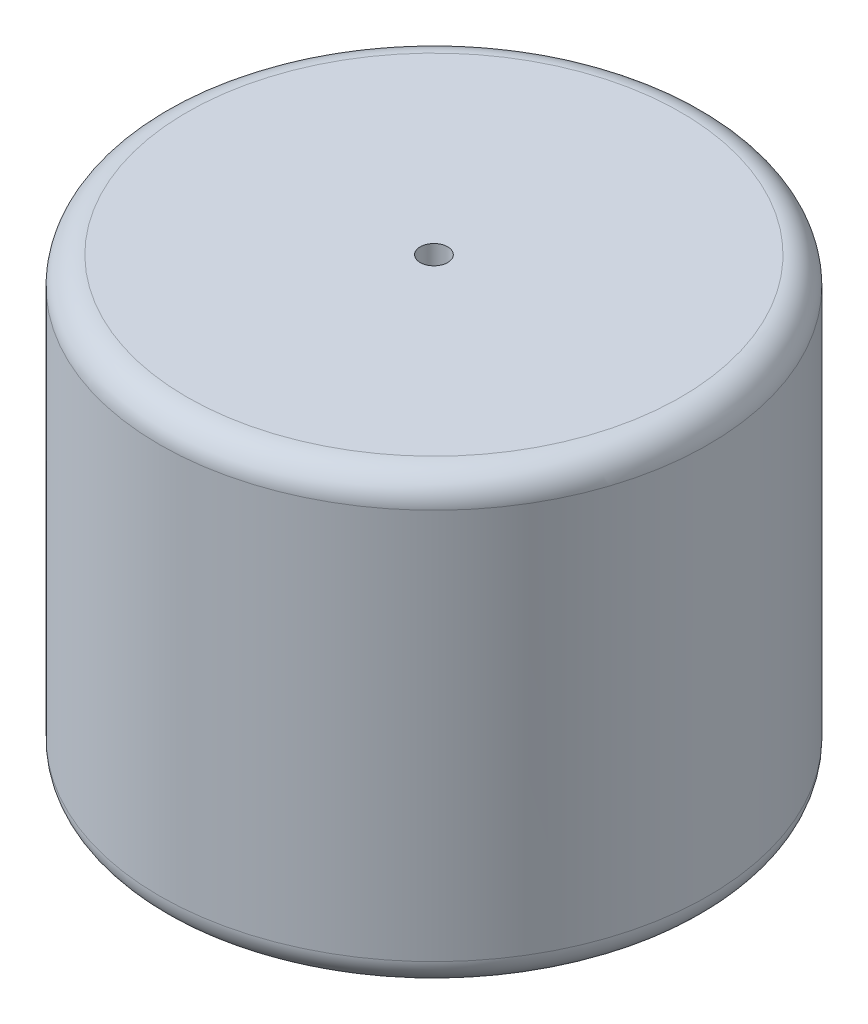
from build123d import *

# Parameters (mm, degrees)
SKETCH1_R           = 20
BOSS_EXTRUDE1_DEPTH = 7.5
SKETCH2_R           = 20
SKETCH2_R_2         = 12.5
BOSS_EXTRUDE2_DEPTH = 15
SKETCH3_R           = 20
BOSS_EXTRUDE3_DEPTH = 10
CUT_EXTRUDE2_DEPTH  = 5
CUT_EXTRUDE3_DEPTH  = 44.084219849
SKETCH6_R           = 8
CUT_EXTRUDE4_DEPTH  = 5
SKETCH7_R           = 2.1
CUT_EXTRUDE5_DEPTH  = 4.5
SKETCH8_R           = 1
CUT_EXTRUDE6_DEPTH  = 41.868692174
FILLET1_R           = 1.5
FILLET2_R           = 2


with BuildPart() as part:
    # Sketch1 → Boss-Extrude1 (new body)
    with BuildSketch(Plane(origin=(0, 0, 0), x_dir=(1, 0, 0), z_dir=(0, 1, 0))):
        with Locations(Location((0, 0, 0), (0, 0, 270))):
            Circle(SKETCH1_R)
    extrude(amount=-BOSS_EXTRUDE1_DEPTH)

    # Sketch2 → Boss-Extrude2 (add)
    with BuildSketch(Plane.XZ.offset(7.5)):
        with Locations(Location((0, 0, 0), (0, 0, 90))):
            Circle(SKETCH2_R)
        with Locations(Location((0, 0, 0), (0, 0, 270))):
            Circle(SKETCH2_R_2, mode=Mode.SUBTRACT)
    extrude(amount=BOSS_EXTRUDE2_DEPTH)

    # Sketch3 → Boss-Extrude3 (add)
    with BuildSketch(Plane.XZ.offset(22.5)):
        with Locations(Location((0, 0, 0), (0, 0, 90))):
            Circle(SKETCH3_R)
    extrude(amount=BOSS_EXTRUDE3_DEPTH)

    # Sketch4 → Cut-Extrude2 (cut)
    with BuildSketch(Plane(origin=(0, -22.5, 0), x_dir=(-1, 0, 0), z_dir=(0, -1, 0))):
        Polygon((10.164510853, 5.47869076), (0.337570049, 11.542069996), (-9.826940805, 6.063379236), (-10.164510853, -5.47869076), (-0.337570049, -11.542069996), (9.826940805, -6.063379236), align=None)
    extrude(amount=CUT_EXTRUDE2_DEPTH, mode=Mode.SUBTRACT)

    # Sketch5 → Cut-Extrude3 (cut, through all)
    with BuildSketch(Plane(origin=(0, 0, 0), x_dir=(0, 0, -1), z_dir=(1, 0, 0))):
        Polygon((7.5, -17.5), (12.5, -17.5), (12.5, -7.5), (-12.5, -7.5), (-12.5, -17.5), (-7.5, -17.5), (-7.5, -32.5), (7.5, -32.5), align=None)
    extrude(amount=-CUT_EXTRUDE3_DEPTH, mode=Mode.SUBTRACT)

    # Sketch6 → Cut-Extrude4 (cut)
    with BuildSketch(Plane.XZ.offset(32.5)):
        Circle(SKETCH6_R)
    extrude(amount=-CUT_EXTRUDE4_DEPTH, mode=Mode.SUBTRACT)

    # Sketch7 → Cut-Extrude5 (cut)
    with BuildSketch(Plane.XZ.offset(7.5)):
        with Locations(Location((0, 0, 0), (0, 0, 270))):
            Circle(SKETCH7_R)
    extrude(amount=-CUT_EXTRUDE5_DEPTH, mode=Mode.SUBTRACT)

    # Sketch8 → Cut-Extrude6 (cut, through all)
    with BuildSketch(Plane.XZ.offset(3)):
        with Locations(Location((0, 0, 0), (0, 0, 270))):
            Circle(SKETCH8_R)
    extrude(amount=-CUT_EXTRUDE6_DEPTH, mode=Mode.SUBTRACT)

    # Fillet1
    fillet1_edges = [part.edges().sort_by_distance(p)[0] for p in [
        (0, -7.5, 2.1),
    ]]
    fillet(fillet1_edges, radius=FILLET1_R)

    # Fillet2
    fillet2_edges = [part.edges().sort_by_distance(p)[0] for p in [
        (0, 0, -20),
        (16.583123952, -32.5, -11.180339887),
    ]]
    fillet(fillet2_edges, radius=FILLET2_R)


solid = part.part
